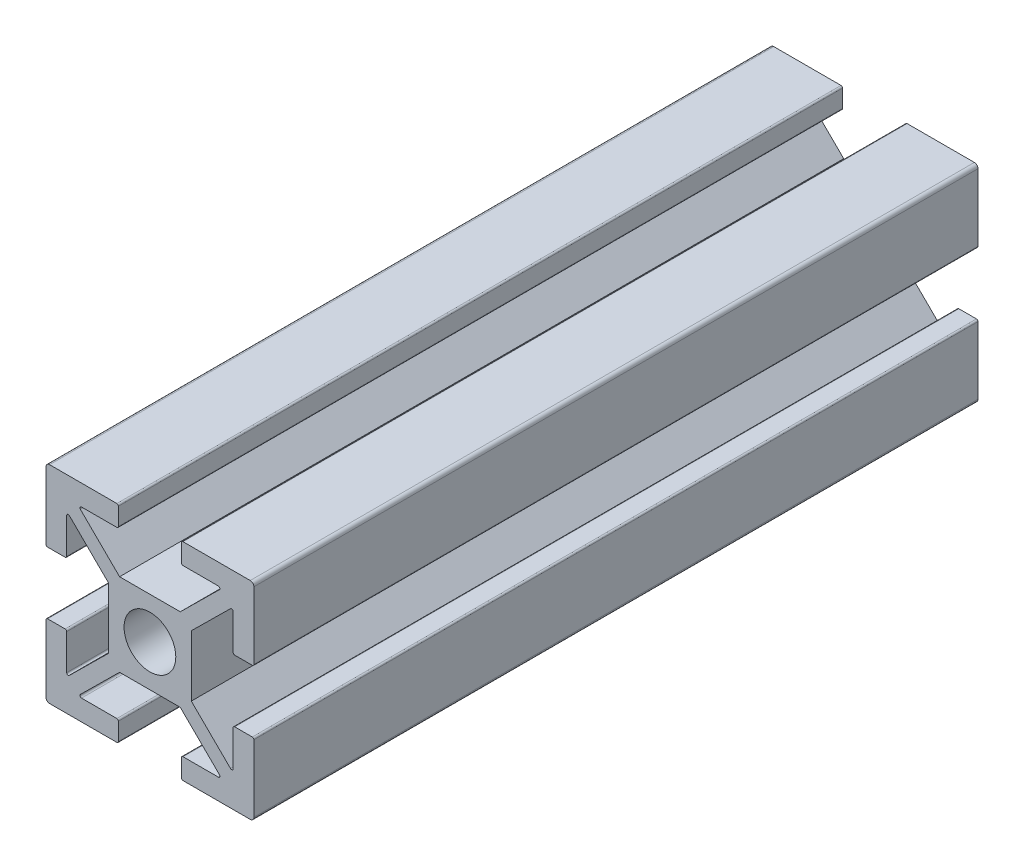
from build123d import *

# Parameters (mm, degrees)
SKETCH1_R           = 2.5
BOSS_EXTRUDE1_DEPTH = 70


with BuildPart() as part:
    # Sketch1 → Boss-Extrude1 (new body)
    with BuildSketch(Plane.XY):
        with BuildLine():
            Line((-31.376404226, -0.06181021), (-29.676404226, -0.06181021))
            ThreePointArc((-29.676404226, -0.06181021), (-29.570338208, -0.017876227), (-29.526404226, 0.08818979))
            Line((-29.526404226, 0.08818979), (-29.526404226, 3.524374304))
            ThreePointArc((-29.526404226, 3.524374304), (-29.43420518, 3.662790523), (-29.27095023, 3.631048831))
            Line((-29.27095023, 3.631048831), (-25.480107929, -0.116419988))
            Line((-25.480107929, -0.116419988), (-25.480107929, -6.007200432))
            Line((-25.480107929, -6.007200432), (-29.27095023, -9.754669251))
            ThreePointArc((-29.27095023, -9.754669251), (-29.43420518, -9.786410942), (-29.526404226, -9.647994723))
            Line((-29.526404226, -9.647994723), (-29.526404226, -6.21181021))
            ThreePointArc((-29.526404226, -6.21181021), (-29.570338208, -6.105744193), (-29.676404226, -6.06181021))
            Line((-29.676404226, -6.06181021), (-31.376404226, -6.06181021))
            ThreePointArc((-31.376404226, -6.06181021), (-31.482470243, -6.105744193), (-31.526404226, -6.21181021))
            Line((-31.526404226, -6.21181021), (-31.526404226, -12.71181021))
            ThreePointArc((-31.526404226, -12.71181021), (-31.423891599, -12.959297583), (-31.176404226, -13.06181021))
            Line((-31.176404226, -13.06181021), (-24.676404226, -13.06181021))
            ThreePointArc((-24.676404226, -13.06181021), (-24.570338208, -13.017876227), (-24.526404226, -12.91181021))
            Line((-24.526404226, -12.91181021), (-24.526404226, -11.21181021))
            ThreePointArc((-24.526404226, -11.21181021), (-24.570338208, -11.105744193), (-24.676404226, -11.06181021))
            Line((-24.676404226, -11.06181021), (-28.094489023, -11.06181021))
            ThreePointArc((-28.094489023, -11.06181021), (-28.233235517, -10.96881381), (-28.199943018, -10.805135682))
            Line((-28.199943018, -10.805135682), (-24.41329202, -7.06181021))
            Line((-24.41329202, -7.06181021), (-18.546923839, -7.06181021))
            Line((-18.546923839, -7.06181021), (-14.760272841, -10.805135682))
            ThreePointArc((-14.760272841, -10.805135682), (-14.726980342, -10.96881381), (-14.865726836, -11.06181021))
            Line((-14.865726836, -11.06181021), (-18.283811633, -11.06181021))
            ThreePointArc((-18.283811633, -11.06181021), (-18.38987765, -11.105744193), (-18.433811633, -11.21181021))
            Line((-18.433811633, -11.21181021), (-18.433811633, -12.91181021))
            ThreePointArc((-18.433811633, -12.91181021), (-18.38987765, -13.017876227), (-18.283811633, -13.06181021))
            Line((-18.283811633, -13.06181021), (-11.783811633, -13.06181021))
            ThreePointArc((-11.783811633, -13.06181021), (-11.53632426, -12.959297583), (-11.433811633, -12.71181021))
            Line((-11.433811633, -12.71181021), (-11.433811633, -6.21181021))
            ThreePointArc((-11.433811633, -6.21181021), (-11.477745616, -6.105744193), (-11.583811633, -6.06181021))
            Line((-11.583811633, -6.06181021), (-13.283811633, -6.06181021))
            ThreePointArc((-13.283811633, -6.06181021), (-13.38987765, -6.105744193), (-13.433811633, -6.21181021))
            Line((-13.433811633, -6.21181021), (-13.433811633, -9.647994723))
            ThreePointArc((-13.433811633, -9.647994723), (-13.526010678, -9.786410942), (-13.689265628, -9.754669251))
            Line((-13.689265628, -9.754669251), (-17.480107929, -6.007200432))
            Line((-17.480107929, -6.007200432), (-17.480107929, -0.116419988))
            Line((-17.480107929, -0.116419988), (-13.689265628, 3.631048831))
            ThreePointArc((-13.689265628, 3.631048831), (-13.526010678, 3.662790523), (-13.433811633, 3.524374304))
            Line((-13.433811633, 3.524374304), (-13.433811633, 0.08818979))
            ThreePointArc((-13.433811633, 0.08818979), (-13.38987765, -0.017876227), (-13.283811633, -0.06181021))
            Line((-13.283811633, -0.06181021), (-11.583811633, -0.06181021))
            ThreePointArc((-11.583811633, -0.06181021), (-11.477745616, -0.017876227), (-11.433811633, 0.08818979))
            Line((-11.433811633, 0.08818979), (-11.433811633, 6.58818979))
            ThreePointArc((-11.433811633, 6.58818979), (-11.53632426, 6.835677164), (-11.783811633, 6.93818979))
            Line((-11.783811633, 6.93818979), (-18.283811633, 6.93818979))
            ThreePointArc((-18.283811633, 6.93818979), (-18.38987765, 6.894255807), (-18.433811633, 6.78818979))
            Line((-18.433811633, 6.78818979), (-18.433811633, 5.08818979))
            ThreePointArc((-18.433811633, 5.08818979), (-18.38987765, 4.982123773), (-18.283811633, 4.93818979))
            Line((-18.283811633, 4.93818979), (-14.865726836, 4.93818979))
            ThreePointArc((-14.865726836, 4.93818979), (-14.726980342, 4.84519339), (-14.760272841, 4.681515262))
            Line((-14.760272841, 4.681515262), (-18.546923839, 0.93818979))
            Line((-18.546923839, 0.93818979), (-24.41329202, 0.93818979))
            Line((-24.41329202, 0.93818979), (-28.199943018, 4.681515262))
            ThreePointArc((-28.199943018, 4.681515262), (-28.233235517, 4.84519339), (-28.094489023, 4.93818979))
            Line((-28.094489023, 4.93818979), (-24.676404226, 4.93818979))
            ThreePointArc((-24.676404226, 4.93818979), (-24.570338208, 4.982123773), (-24.526404226, 5.08818979))
            Line((-24.526404226, 5.08818979), (-24.526404226, 6.78818979))
            ThreePointArc((-24.526404226, 6.78818979), (-24.570338208, 6.894255807), (-24.676404226, 6.93818979))
            Line((-24.676404226, 6.93818979), (-31.176404226, 6.93818979))
            ThreePointArc((-31.176404226, 6.93818979), (-31.423891599, 6.835677164), (-31.526404226, 6.58818979))
            Line((-31.526404226, 6.58818979), (-31.526404226, 0.08818979))
            ThreePointArc((-31.526404226, 0.08818979), (-31.482470243, -0.017876227), (-31.376404226, -0.06181021))
        make_face()
        with Locations((-21.480107929, -3.06181021)):
            Circle(SKETCH1_R, mode=Mode.SUBTRACT)
    extrude(amount=BOSS_EXTRUDE1_DEPTH)


solid = part.part
